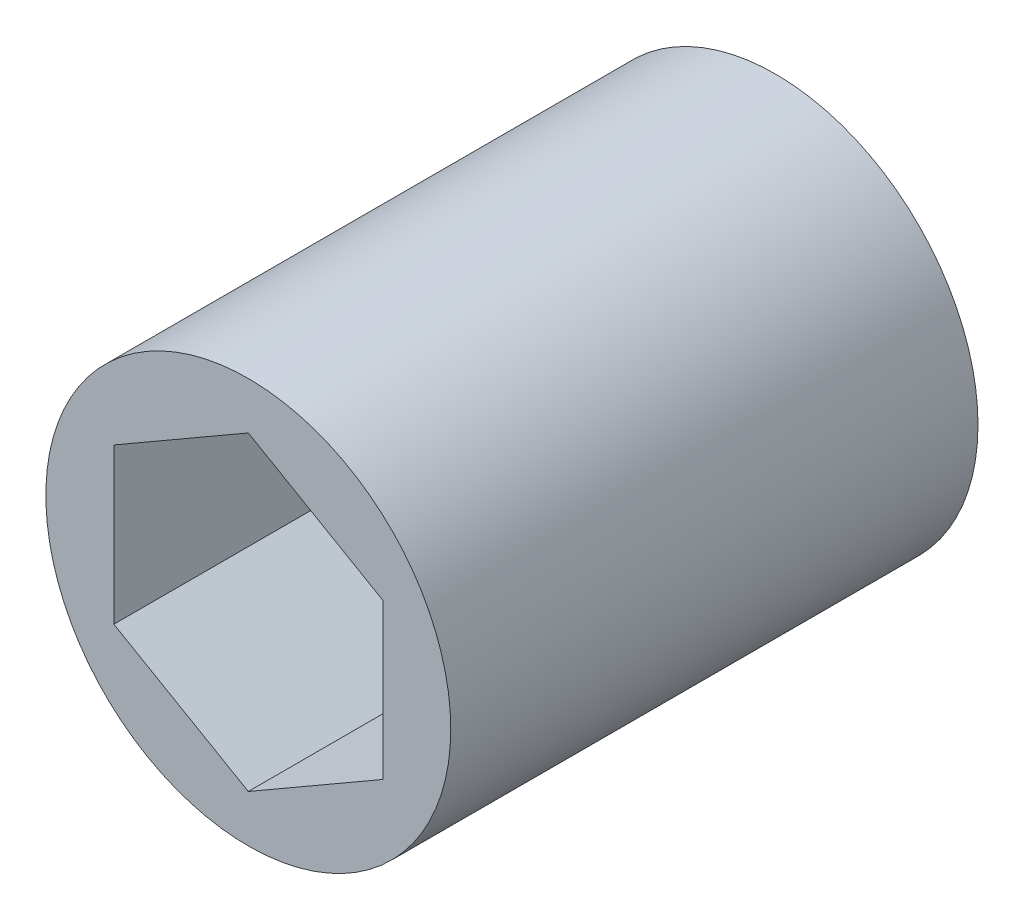
from build123d import *

# Parameters (mm, degrees)
SKETCH1_R           = 9.7536
BOSS_EXTRUDE1_DEPTH = 25.4


with BuildPart() as part:
    # Sketch1 → Boss-Extrude1 (new body)
    with BuildSketch(Plane.XY):
        Circle(SKETCH1_R)
        Polygon((0, 7.478995387), (-6.477, 3.739497694), (-6.477, -3.739497694), (0, -7.478995387), (6.477, -3.739497694), (6.477, 3.739497694), align=None, mode=Mode.SUBTRACT)
    extrude(amount=BOSS_EXTRUDE1_DEPTH)


solid = part.part
